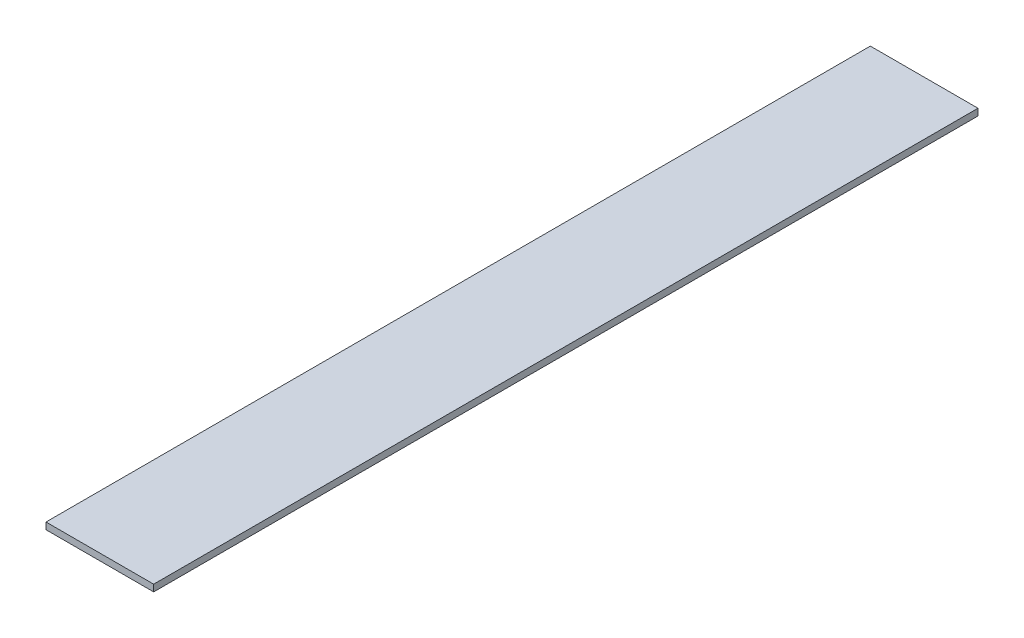
from build123d import *

# Parameters (mm, degrees)
SKETCH_1_W      = 32
SKETCH_1_H      = 245
EXTRUDE_1_DEPTH = 2


with BuildPart() as part:
    # 草图1 → 凸台-拉伸1 (new body)
    with BuildSketch(Plane(origin=(0, 0, 0), x_dir=(1, 0, 0), z_dir=(0, 1, 0))):
        with Locations((16, 122.5)):
            Rectangle(SKETCH_1_W, SKETCH_1_H)
    extrude(amount=EXTRUDE_1_DEPTH)


solid = part.part
